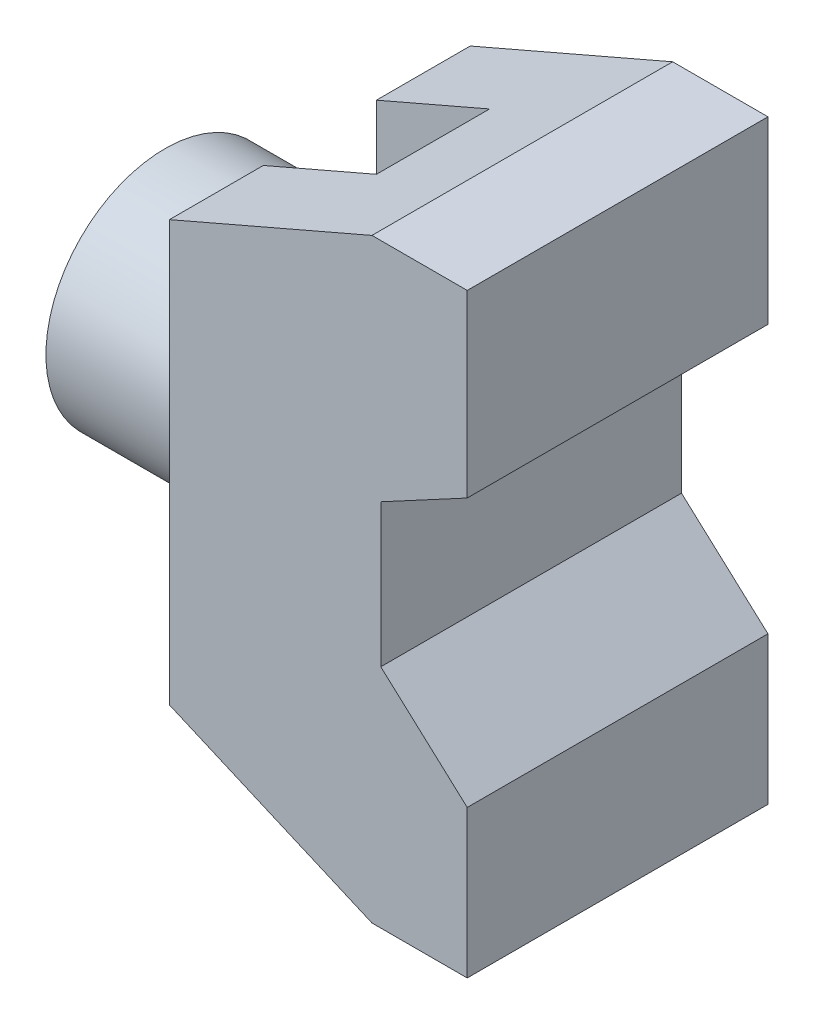
from build123d import *

# Parameters (mm, degrees)
SKETCH2_R           = 20
SKETCH2_R_2         = 10
BOSS_EXTRUDE1_DEPTH = 26
SKETCH3_W           = 50.5
SKETCH3_H           = 100
BOSS_EXTRUDE2_DEPTH = 50
SKETCH6_W           = 19
SKETCH6_H           = 19
CUT_EXTRUDE1_DEPTH  = 129.115426472
CUT_EXTRUDE5_DEPTH  = 105.049267177
CUT_EXTRUDE6_DEPTH  = 105.049267177


with BuildPart() as part:
    # Sketch2 → Boss-Extrude1 (new body)
    with BuildSketch(Plane(origin=(0, 0, 0), x_dir=(0, 0, -1), z_dir=(1, 0, 0))):
        with Locations(Location((0, 0, 0), (0, 0, 180))):
            Circle(SKETCH2_R)
        with Locations(Location((0, 0, 0), (0, 0, 180))):
            Circle(SKETCH2_R_2, mode=Mode.SUBTRACT)
    extrude(amount=BOSS_EXTRUDE1_DEPTH)

    # Sketch3 → Boss-Extrude2 (add)
    with BuildSketch(Plane(origin=(26, 0, 0), x_dir=(0, 0, -1), z_dir=(1, 0, 0))):
        Rectangle(SKETCH3_W, SKETCH3_H)
    extrude(amount=BOSS_EXTRUDE2_DEPTH)

    # Sketch6 → Cut-Extrude1 (cut, through all)
    with BuildSketch(Plane.XZ.offset(50)):
        with Locations((35.5, 0)):
            Rectangle(SKETCH6_W, SKETCH6_H)
    extrude(amount=-CUT_EXTRUDE1_DEPTH, mode=Mode.SUBTRACT)

    # Sketch7 → Cut-Extrude5 (cut, through all)
    with BuildSketch(Plane(origin=(0, 0, -25.25), x_dir=(-1, 0, 0), z_dir=(0, 0, -1))):
        Polygon((-60, 50), (-26, 50), (-26, 35.294942904), align=None)
        Polygon((-60, -50), (-26, -35.294942904), (-26, -50), align=None)
    extrude(amount=-CUT_EXTRUDE5_DEPTH, mode=Mode.SUBTRACT)

    # Sketch9 → Cut-Extrude6 (cut, through all)
    with BuildSketch(Plane(origin=(0, 0, -25.25), x_dir=(-1, 0, 0), z_dir=(0, 0, -1))):
        Polygon((-76, 19.807249774), (-76, -25.192750226), (-61.483507586, -12), (-61.483507586, 12), align=None)
    extrude(amount=-CUT_EXTRUDE6_DEPTH, mode=Mode.SUBTRACT)


solid = part.part
